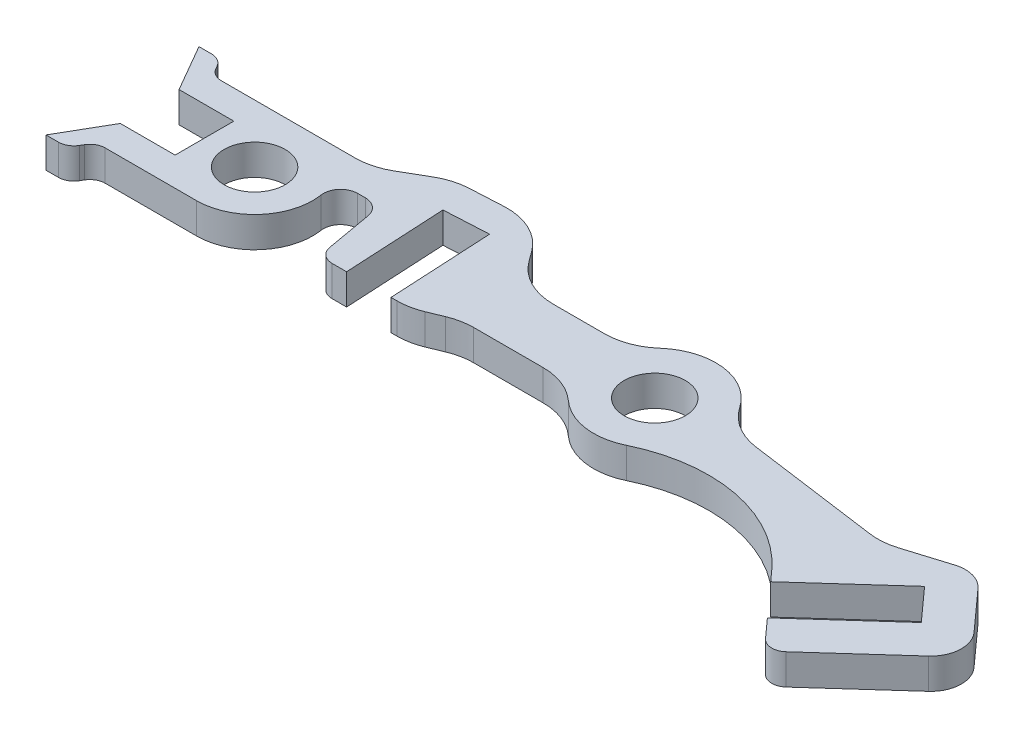
from build123d import *

# Parameters (mm, degrees)
SKETCH_2_R          = 5
EXTRUDE_1_DEPTH     = 5
CUT_EXTRUDE_1_DEPTH = 92.187134051
FILLET_1_R          = 2.8
FILLET_2_R          = 2.8
FILLET_3_R          = 10
FILLET_4_R          = 5
FILLET_5_R          = 2.5
FILLET_6_R          = 10


with BuildPart() as part:
    # 草图2 → 凸台-拉伸1 (new body)
    # profile 1 of 2: a face of its own
    with BuildSketch(Plane(origin=(0, 0, 0), x_dir=(1, 0, 0), z_dir=(0, 1, 0))):
        with BuildLine():
            Line((-55.8, 9.5), (-65.4, 9.5))
            ThreePointArc((-65.4, 9.5), (-60.625065445, 8.212794896), (-57.144093024, 4.7))
            Line((-57.144093024, 4.7), (-49.644093024, 4.7))
            Line((-49.644093024, 4.7), (-47.528169255, -7.3))
            Line((-47.528169255, -7.3), (-32.828169255, -7.3))
            Line((-32.828169255, -7.3), (-26.77268488, -4.8))
            Line((-26.77268488, -4.8), (-8.77268488, -4.8))
            ThreePointArc((-8.77268488, -4.8), (-3.040245716, -9.526641905), (4.370469962, -8.994386711))
            ThreePointArc((4.370469962, -8.994386711), (20.084939282, -6.943193169), (33.875265504, -14.75208833))
            Line((33.875265504, -14.75208833), (44.771139737, -26.853182613))
            Line((44.771139737, -26.853182613), (62.606615548, -10.794048061))
            Line((62.606615548, -10.794048061), (51.23139524, 1.839413972))
            Line((51.23139524, 1.839413972), (39, -1.933246956))
            Line((39, -1.933246956), (9.777013859, 2.1))
            ThreePointArc((9.777013859, 2.1), (1.554340892, 9.878462653), (-8.659704384, 5.000951907))
            Line((-8.659704384, 5.000951907), (-26.659704384, 5.000951907))
            Line((-26.659704384, 5.000951907), (-34.031178231, 15.096068218))
            Line((-34.031178231, 15.096068218), (-47.312951043, 14.4))
            Line((-47.312951043, 14.4), (-55.8, 9.5))
        make_face()
        with Locations(Location((0, 0, 0), (0, 0, 270))):
            Circle(SKETCH_2_R, mode=Mode.SUBTRACT)
    # profile 2 of 2: a face of its own
    with BuildSketch(Plane(origin=(0, 0, 0), x_dir=(1, 0, 0), z_dir=(0, 1, 0))):
        with BuildLine():
            Line((-80.324573519, -9.5), (-65.4, -9.5))
            ThreePointArc((-65.4, -9.5), (-55.9, 0), (-65.4, 9.5))
            Line((-65.4, 9.5), (-80.324573519, 9.5))
            ThreePointArc((-80.324573519, 9.5), (-81.574573519, 9.834936491), (-82.489637029, 10.75))
            Line((-82.489637029, 10.75), (-83.5, 12.5))
            Line((-83.5, 12.5), (-87, 12.5))
            Line((-87, 12.5), (-82.554402927, 4.8))
            Line((-82.554402927, 4.8), (-73.598170528, 4.8))
            Line((-73.598170528, 4.8), (-73.598170528, -4.8))
            Line((-73.598170528, -4.8), (-82.554402927, -4.8))
            Line((-82.554402927, -4.8), (-87, -12.5))
            Line((-87, -12.5), (-83.5, -12.5))
            Line((-83.5, -12.5), (-82.489637029, -10.75))
            ThreePointArc((-82.489637029, -10.75), (-81.574573519, -9.834936491), (-80.324573519, -9.5))
        make_face()
        with Locations(Location((-65.4, 0, 0), (0, 0, 270))):
            Circle(SKETCH_2_R, mode=Mode.SUBTRACT)
    extrude(amount=-EXTRUDE_1_DEPTH)

    # 草图4 → 切除-拉伸1 (cut, through all)
    with BuildSketch(Plane(origin=(0, -5, 0), x_dir=(-1, 0, 0), z_dir=(0, -1, 0))):
        Polygon((42.343817462, -21.137636493), (43.940064127, 9.320564317), (36.7, 9.7), (35.103753335, -20.75820081), align=None)
        Polygon((-48.7, -4.6), (-26.034082823, -25.008483494), (-30.885279719, -30.396283479), (-53.551196896, -9.987799985), align=None)
    extrude(amount=-CUT_EXTRUDE_1_DEPTH, mode=Mode.SUBTRACT)

    # 圆角1
    fillet_1_edges = [part.edges().sort_by_distance(p)[0] for p in [
        (-57.144093024, -2.5, -4.7),
    ]]
    fillet(fillet_1_edges, radius=FILLET_1_R)

    # 圆角2
    fillet_2_edges = [part.edges().sort_by_distance(p)[0] for p in [
        (-49.644093024, -2.5, -4.7),
    ]]
    fillet(fillet_2_edges, radius=FILLET_2_R)

    # 圆角3
    fillet_3_edges = [part.edges().sort_by_distance(p)[0] for p in [
        (-47.312951043, -2.5, -14.4),
        (-34.031178231, -2.5, -15.096068218),
        (-26.659704384, -2.5, -5.000951907),
        (-8.659704384, -2.5, -5.000951907),
        (9.777013859, -2.5, -2.1),
        (39, -2.5, 1.933246956),
        (-8.77268488, -2.5, 4.8),
        (-26.77268488, -2.5, 4.8),
        (-32.828169255, -2.5, 7.3),
    ]]
    fillet(fillet_3_edges, radius=FILLET_3_R)

    # 圆角4
    fillet_4_edges = [part.edges().sort_by_distance(p)[0] for p in [
        (51.23139524, -2.5, -1.839413972),
        (62.606615548, -2.5, 10.794048061),
    ]]
    fillet(fillet_4_edges, radius=FILLET_4_R)

    # 圆角5
    fillet_5_edges = [part.edges().sort_by_distance(p)[0] for p in [
        (44.771139737, -2.5, 26.853182613),
        (-47.528169255, -2.5, 7.3),
        (-83.5, -2.5, 12.5),
        (-83.5, -2.5, -12.5),
    ]]
    fillet(fillet_5_edges, radius=FILLET_5_R)

    # 圆角6
    fillet_6_edges = [part.edges().sort_by_distance(p)[0] for p in [
        (-55.8, -2.5, -9.5),
    ]]
    fillet(fillet_6_edges, radius=FILLET_6_R)


solid = part.part
